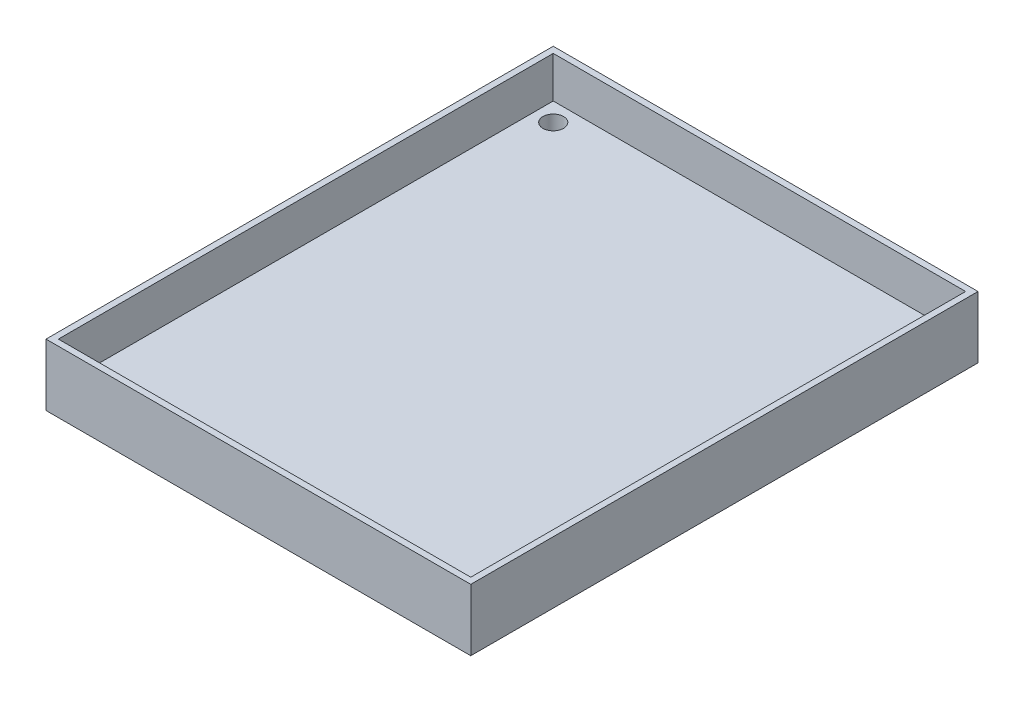
from build123d import *

# Parameters (mm, degrees)
SKETCH1_W           = 206
SKETCH1_H           = 246
BOSS_EXTRUDE1_DEPTH = 60
SKETCH2_W           = 200
SKETCH2_H           = 240
CUT_EXTRUDE1_DEPTH  = 50
CUT_EXTRUDE3_DEPTH  = 172.283390905
SKETCH5_W           = 206
SKETCH5_H           = 246
CUT_EXTRUDE4_DEPTH  = 30
SKETCH6_W           = 130
SKETCH6_H           = 60
CUT_EXTRUDE5_DEPTH  = 5


with BuildPart() as part:
    # Sketch1 → Boss-Extrude1 (new body)
    with BuildSketch(Plane(origin=(0, 0, 0), x_dir=(1, 0, 0), z_dir=(0, 1, 0))):
        Rectangle(SKETCH1_W, SKETCH1_H)
    extrude(amount=BOSS_EXTRUDE1_DEPTH)

    # Sketch2 → Cut-Extrude1 (cut)
    with BuildSketch(Plane(origin=(0, 60, 0), x_dir=(1, 0, 0), z_dir=(0, 1, 0))):
        Rectangle(SKETCH2_W, SKETCH2_H)
    extrude(amount=-CUT_EXTRUDE1_DEPTH, mode=Mode.SUBTRACT)

    # Sketch3 → Cut-Extrude3 (cut, through all)
    with BuildSketch(Plane.XZ):
        with BuildLine():
            Line((-91, 106), (-91, 111))
            Line((-91, 111), (-86, 111))
            ThreePointArc((-86, 111), (-94.535533906, 114.535533906), (-91, 106))
        make_face()
        with BuildLine():
            Line((-86, 111), (-91, 111))
            Line((-91, 111), (-91, 106))
            ThreePointArc((-91, 106), (-87.464466094, 107.464466094), (-86, 111))
        make_face()
        with BuildLine():
            ThreePointArc((96, 111), (91, 116), (86, 111))
            Line((86, 111), (91, 111))
            Line((91, 111), (91, 106))
            ThreePointArc((91, 106), (94.535533906, 107.464466094), (96, 111))
        make_face()
        with BuildLine():
            Line((91, 111), (86, 111))
            ThreePointArc((86, 111), (87.464466094, 107.464466094), (91, 106))
            Line((91, 106), (91, 111))
        make_face()
        with BuildLine():
            ThreePointArc((96, -111), (94.535533906, -107.464466094), (91, -106))
            Line((91, -106), (91, -111))
            Line((91, -111), (86, -111))
            ThreePointArc((86, -111), (91, -116), (96, -111))
        make_face()
        with BuildLine():
            Line((91, -111), (91, -106))
            ThreePointArc((91, -106), (87.464466094, -107.464466094), (86, -111))
            Line((86, -111), (91, -111))
        make_face()
        with BuildLine():
            ThreePointArc((-86, -111), (-87.464466094, -107.464466094), (-91, -106))
            Line((-91, -106), (-91, -111))
            Line((-91, -111), (-86, -111))
        make_face()
        with BuildLine():
            Line((-91, -111), (-91, -106))
            ThreePointArc((-91, -106), (-94.535533906, -114.535533906), (-86, -111))
            Line((-86, -111), (-91, -111))
        make_face()
    extrude(amount=-CUT_EXTRUDE3_DEPTH, mode=Mode.SUBTRACT)

    # Sketch5 → Cut-Extrude4 (cut)
    with BuildSketch(Plane(origin=(0, 60, 0), x_dir=(1, 0, 0), z_dir=(0, 1, 0))):
        Rectangle(SKETCH5_W, SKETCH5_H)
    extrude(amount=-CUT_EXTRUDE4_DEPTH, mode=Mode.SUBTRACT)

    # Sketch6 → Cut-Extrude5 (cut)
    with BuildSketch(Plane.XZ):
        Rectangle(SKETCH6_W, SKETCH6_H)
    extrude(amount=-CUT_EXTRUDE5_DEPTH, mode=Mode.SUBTRACT)


solid = part.part
